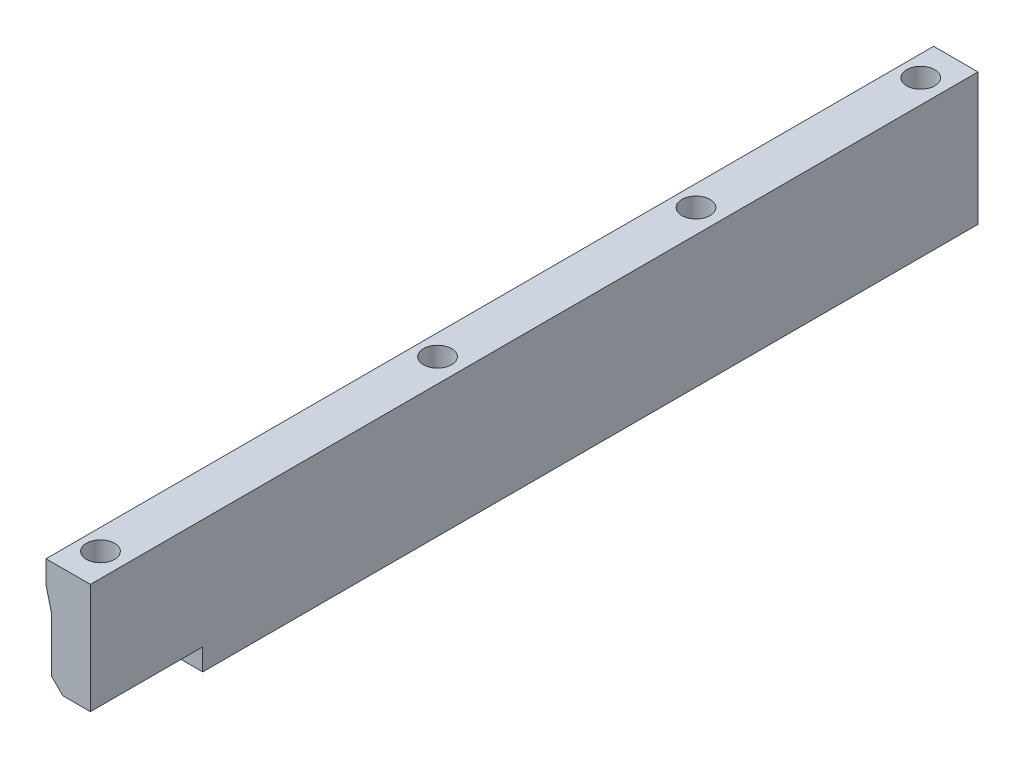
from build123d import *

# Parameters (mm, degrees)
BOSS_EXTRUDE1_DEPTH                     = 138
BOSS_EXTRUDE2_DEPTH                     = 20
CBORE_FOR_M5_HEX_HEAD_BOLT1_D           = 3.2
CBORE_FOR_M5_HEX_HEAD_BOLT1_DEPTH       = 15
CBORE_FOR_M5_HEX_HEAD_BOLT1_CBORE_D     = 5
CBORE_FOR_M5_HEX_HEAD_BOLT1_CBORE_DEPTH = 5
CHAMFER1_SIZE                           = 2


with BuildPart() as part:
    # Sketch1 → Boss-Extrude1 (new body)
    with BuildSketch(Plane.XY):
        Polygon((-48.6, -2.25), (-48.6, 2.25), (-45.4, 2.25), (-45.4, 6.25), (-46.4, 10.25), (-46.4, 14.25), (-45.4, 14.25), (-38.5, 14.25), (-38.5, -9.25), (-45.4, -9.25), (-45.4, -2.25), align=None)
    extrude(amount=-BOSS_EXTRUDE1_DEPTH)

    # Sketch2 → Boss-Extrude2 (add)
    with BuildSketch(Plane.XY):
        Polygon((-38.5, -5.376545905), (-38.5, 14.25), (-44.4, 14.25), (-46.4, 14.25), (-46.4, 10.25), (-45.4, 6.25), (-45.4, -5.376545905), align=None)
    extrude(amount=BOSS_EXTRUDE2_DEPTH)

    # CBORE for M5 Hex Head Bolt1
    with Locations(Plane(origin=(-42.7, 14.25, -132), x_dir=(0, 0, 1), z_dir=(0, 1, 0))):
        with Locations((0, 0), (40, 0), (86, 0), (146, 0)):
            CounterBoreHole(CBORE_FOR_M5_HEX_HEAD_BOLT1_D / 2, CBORE_FOR_M5_HEX_HEAD_BOLT1_CBORE_D / 2, CBORE_FOR_M5_HEX_HEAD_BOLT1_CBORE_DEPTH, depth=CBORE_FOR_M5_HEX_HEAD_BOLT1_DEPTH)

    # Chamfer1
    chamfer1_edges = [part.edges().sort_by_distance(p)[0] for p in [
        (-45.4, -9.25, -69),
        (-45.4, -5.376545905, 10),
    ]]
    chamfer(chamfer1_edges, length=CHAMFER1_SIZE)


solid = part.part
